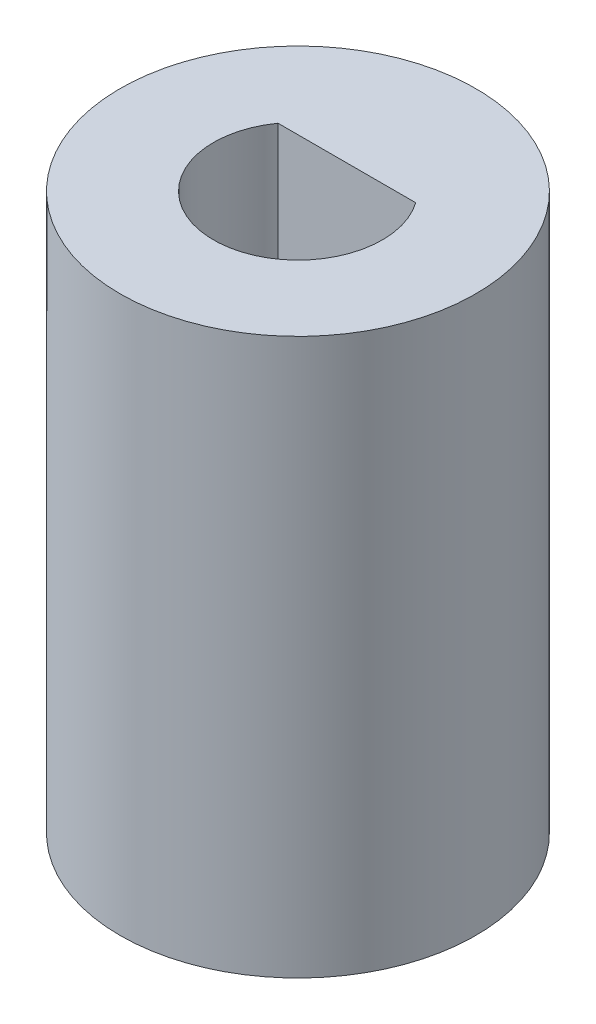
from build123d import *

# Parameters (mm, degrees)
SKETCH1_R           = 8
BOSS_EXTRUDE1_DEPTH = 25
CUT_EXTRUDE1_DEPTH  = 10


with BuildPart() as part:
    # Sketch1 → Boss-Extrude1 (new body)
    with BuildSketch(Plane(origin=(0, 0, 0), x_dir=(1, 0, 0), z_dir=(0, 1, 0))):
        with Locations(Location((0, 0, 0), (0, 0, 270))):
            Circle(SKETCH1_R)
        with BuildLine():
            ThreePointArc((-3.098386677, 2.2), (0, -3.8), (3.098386677, 2.2))
            Line((3.098386677, 2.2), (-3.098386677, 2.2))
        make_face(mode=Mode.SUBTRACT)
    extrude(amount=BOSS_EXTRUDE1_DEPTH)

    # Sketch2 → Cut-Extrude1 (cut)
    with BuildSketch(Plane.XZ):
        with BuildLine():
            Line((-2.645751311, -3), (2.645751311, -3))
            ThreePointArc((2.645751311, -3), (0, 4), (-2.645751311, -3))
        make_face()
    extrude(amount=-CUT_EXTRUDE1_DEPTH, mode=Mode.SUBTRACT)


solid = part.part
